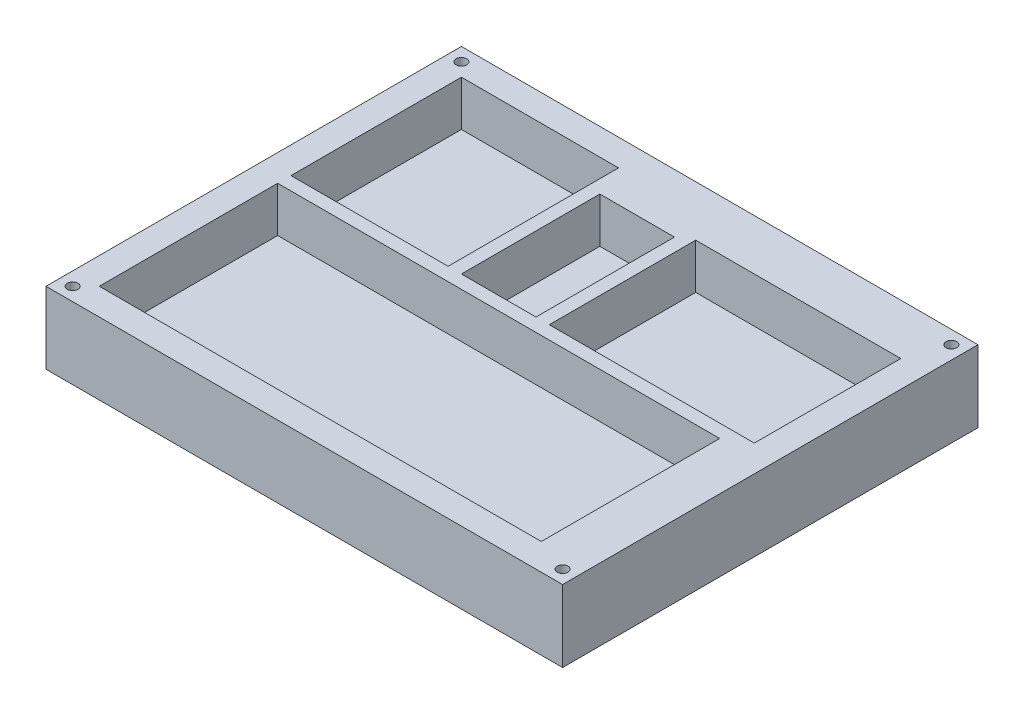
from build123d import *

# Parameters (mm, degrees)
SKETCH1_W           = 194
SKETCH1_H           = 156
SKETCH1_W_2         = 166
SKETCH1_H_2         = 67
SKETCH1_W_3         = 59
SKETCH1_H_3         = 64
SKETCH1_W_4         = 28
SKETCH1_H_4         = 52
SKETCH1_W_5         = 77
SKETCH1_H_5         = 55
BOSS_EXTRUDE1_DEPTH = 17
SKETCH2_W           = 194
SKETCH2_H           = 156
BOSS_EXTRUDE2_DEPTH = 10
SKETCH3_R           = 2
CUT_EXTRUDE1_DEPTH  = 30


with BuildPart() as part:
    # Sketch1 → Boss-Extrude1 (new body)
    with BuildSketch(Plane(origin=(0, 0, 0), x_dir=(1, 0, 0), z_dir=(0, 1, 0))):
        with Locations((4, 34.5)):
            Rectangle(SKETCH1_W, SKETCH1_H)
        Rectangle(SKETCH1_W_2, SKETCH1_H_2, mode=Mode.SUBTRACT)
        with Locations((-53.5, 70.5)):
            Rectangle(SKETCH1_W_3, SKETCH1_H_3, mode=Mode.SUBTRACT)
        with Locations((-5, 64.5)):
            Rectangle(SKETCH1_W_4, SKETCH1_H_4, mode=Mode.SUBTRACT)
        with Locations((52.5, 66)):
            Rectangle(SKETCH1_W_5, SKETCH1_H_5, mode=Mode.SUBTRACT)
    extrude(amount=BOSS_EXTRUDE1_DEPTH)

    # Sketch2 → Boss-Extrude2 (add)
    with BuildSketch(Plane(origin=(0, 0, 0), x_dir=(-1, 0, 0), z_dir=(0, -1, 0))):
        with Locations((-4, 34.5)):
            Rectangle(SKETCH2_W, SKETCH2_H)
    extrude(amount=BOSS_EXTRUDE2_DEPTH)

    # Sketch3 → Cut-Extrude1 (cut)
    with BuildSketch(Plane(origin=(0, -10, 0), x_dir=(-1, 0, 0), z_dir=(0, -1, 0))):
        with Locations(Location((88, -38.5, 0), (0, 0, 90))):
            Circle(SKETCH3_R)
        with Locations(Location((88, 107.5, 0), (0, 0, 90))):
            Circle(SKETCH3_R)
        with Locations(Location((-96, -38.5, 0), (0, 0, 90))):
            Circle(SKETCH3_R)
        with Locations(Location((-96, 107.5, 0), (0, 0, 90))):
            Circle(SKETCH3_R)
    extrude(amount=-CUT_EXTRUDE1_DEPTH, mode=Mode.SUBTRACT)


solid = part.part
